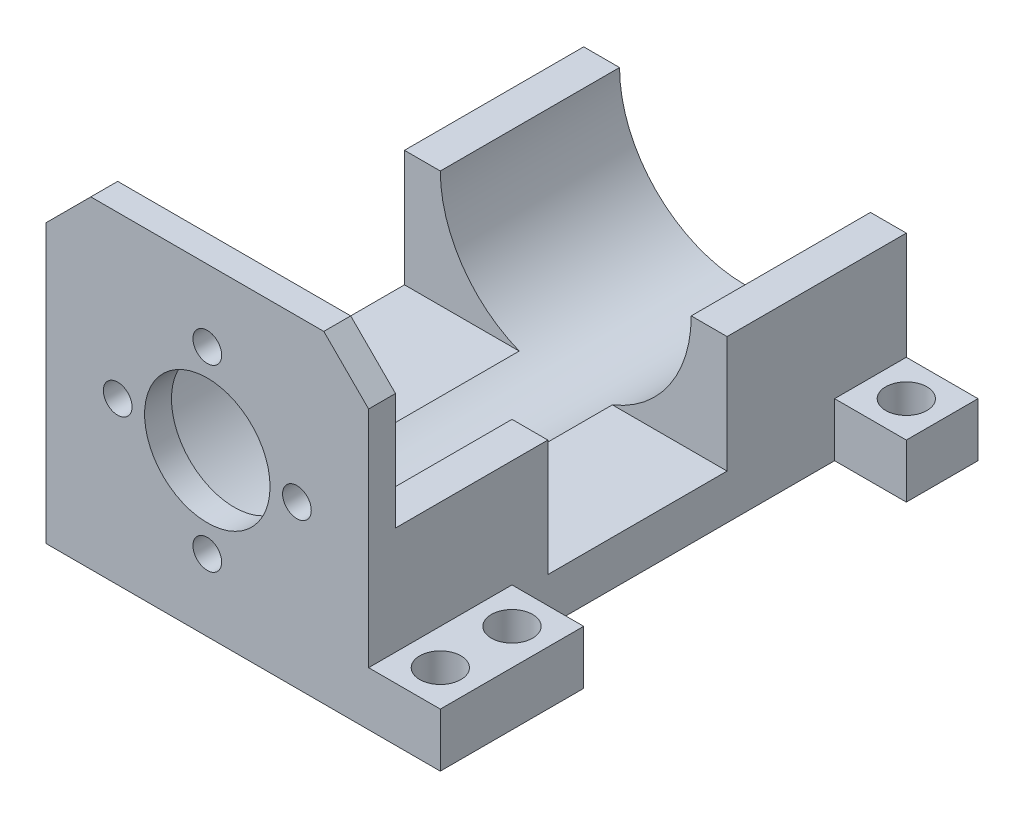
from build123d import *

# Parameters (mm, degrees)
BOSS_EXTRU_1_DEPTH      = 60
ESQUISSE1_3_R           = 1.6
ESQUISSE1_3_R_2         = 7
BOSS_EXTRU_2_DEPTH      = 3
ENL_V_MAT_EXTRU_2_DEPTH = 50
ESQUISSE2_W             = 8
ESQUISSE2_H             = 8
ESQUISSE2_R             = 2.3
ESQUISSE2_H_2           = 16
ESQUISSE2_W_2           = 12
BOSS_EXTRU_4_DEPTH      = 6


with BuildPart() as part:
    # Esquisse1 → Boss.-Extru.1 (new body)
    with BuildSketch(Plane.XY):
        with BuildLine():
            Line((-18, -18), (18, -18))
            Line((18, -18), (18, 0))
            Line((18, 0), (14, 0))
            ThreePointArc((14, 0), (0, -14), (-14, 0))
            Line((-14, 0), (-18, 0))
            Line((-18, 0), (-18, -18))
        make_face()
    extrude(amount=-BOSS_EXTRU_1_DEPTH)

    # Esquisse1<3> → Boss.-Extru.2 (add)
    with BuildSketch(Plane.XY):
        with BuildLine():
            Line((14, 0), (18, 0))
            Line((18, 0), (18, 13))
            Line((18, 13), (13, 18))
            Line((13, 18), (-13, 18))
            Line((-13, 18), (-18, 13))
            Line((-18, 13), (-18, 0))
            Line((-18, 0), (-14, 0))
            ThreePointArc((-14, 0), (0, -14), (14, 0))
        make_face()
        with Locations((0, 10)):
            Circle(ESQUISSE1_3_R, mode=Mode.SUBTRACT)
        with Locations((0, -10)):
            Circle(ESQUISSE1_3_R, mode=Mode.SUBTRACT)
        with Locations((-10, 0)):
            Circle(ESQUISSE1_3_R, mode=Mode.SUBTRACT)
        Circle(ESQUISSE1_3_R_2, mode=Mode.SUBTRACT)
        with Locations((10, 0)):
            Circle(ESQUISSE1_3_R, mode=Mode.SUBTRACT)
    extrude(amount=-BOSS_EXTRU_2_DEPTH)

    # Esquisse3 → Enlèv. mat.-Extru.2 (cut)
    with BuildSketch(Plane.ZY.offset(18)):
        Polygon((-30, 0), (-20, 0), (-20, -13), (-40, -13), (-40, 0), align=None)
    extrude(amount=-ENL_V_MAT_EXTRU_2_DEPTH, mode=Mode.SUBTRACT)

    # Esquisse2 → Boss.-Extru.4 (add)
    # profile 1 of 3: a face of its own
    with BuildSketch(Plane.XZ.offset(18)):
        with Locations((22, -56)):
            Rectangle(ESQUISSE2_W, ESQUISSE2_H)
        with Locations((22, -56)):
            Circle(ESQUISSE2_R, mode=Mode.SUBTRACT)
    # profile 2 of 3: a face of its own
    with BuildSketch(Plane.XZ.offset(18)):
        with Locations((22, -8)):
            Rectangle(ESQUISSE2_W, ESQUISSE2_H_2)
        with Locations((22, -12)):
            Circle(ESQUISSE2_R, mode=Mode.SUBTRACT)
        with Locations((22, -4)):
            Circle(ESQUISSE2_R, mode=Mode.SUBTRACT)
    # profile 3 of 3: a face of its own
    with BuildSketch(Plane.XZ.offset(18)):
        with Locations((-24, -56)):
            Rectangle(ESQUISSE2_W_2, ESQUISSE2_H)
        with Locations((-26, -56)):
            Circle(ESQUISSE2_R, mode=Mode.SUBTRACT)
    extrude(amount=-BOSS_EXTRU_4_DEPTH)


solid = part.part
